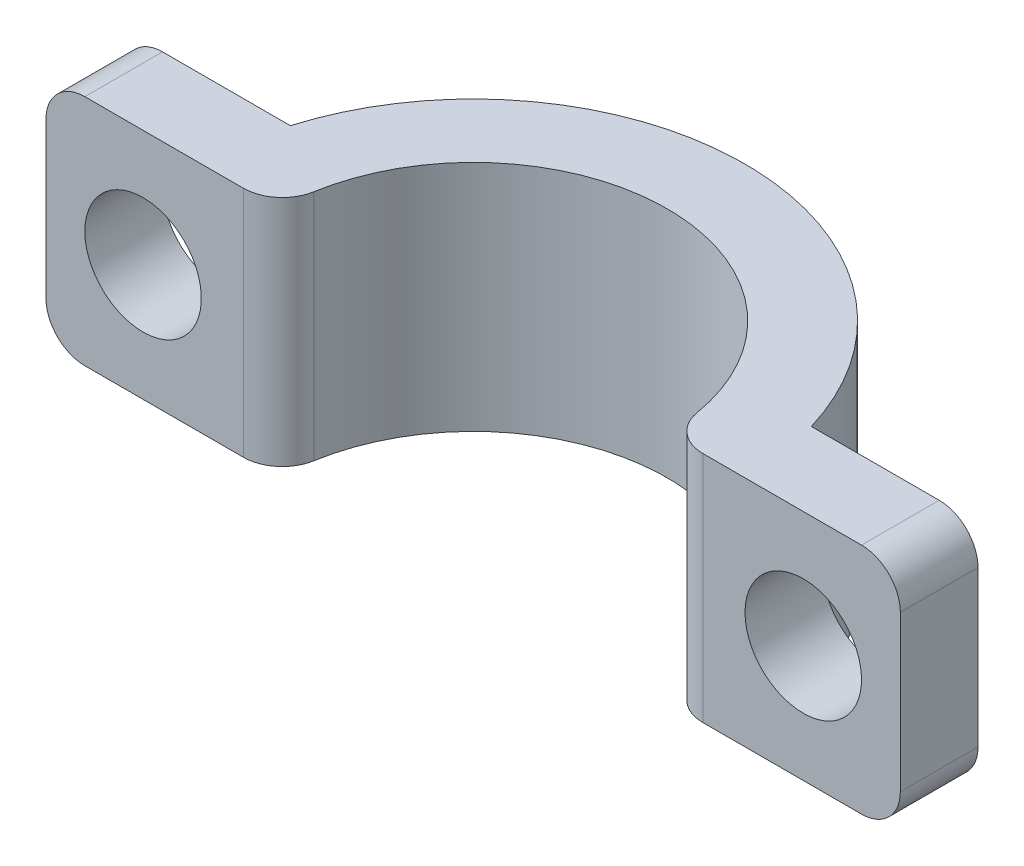
from build123d import *

# Parameters (mm, degrees)
BOSS_EXTRUDE1_DEPTH = 6
BOSS_EXTRUDE2_DEPTH = 6
SKETCH3_R           = 1.5
CUT_EXTRUDE1_DEPTH  = 6
FILLET1_R           = 1


with BuildPart() as part:
    # Sketch1 → Boss-Extrude1 (new body)
    with BuildSketch(Plane(origin=(0, 0, 0), x_dir=(1, 0, 0), z_dir=(0, 1, 0))):
        with BuildLine():
            Line((5, 0), (7, 0))
            ThreePointArc((7, 0), (0, 7), (-7, 0))
            Line((-7, 0), (-5, 0))
            ThreePointArc((-5, 0), (0, 5), (5, 0))
        make_face()
    extrude(amount=BOSS_EXTRUDE1_DEPTH)

    # Sketch2 → Boss-Extrude2 (add)
    with BuildSketch(Plane(origin=(0, 6, 0), x_dir=(1, 0, 0), z_dir=(0, 1, 0))):
        Polygon((7, 0), (11, 0), (11, 2), (6.708203932, 2), align=None)
        Polygon((-6.708203932, 2), (-7, 0), (-11, 0), (-11, 2), align=None)
    extrude(amount=-BOSS_EXTRUDE2_DEPTH)

    # Sketch3 → Cut-Extrude1 (cut)
    with BuildSketch(Plane(origin=(0, 0, -2), x_dir=(-1, 0, 0), z_dir=(0, 0, -1))):
        with Locations((-8.5, 3)):
            Circle(SKETCH3_R)
        with Locations((8.5, 3)):
            Circle(SKETCH3_R)
    extrude(amount=-CUT_EXTRUDE1_DEPTH, mode=Mode.SUBTRACT)

    # Fillet1
    fillet1_edges = [part.edges().sort_by_distance(p)[0] for p in [
        (11, 6, -1),
        (11, 0, -1),
        (-11, 6, -1),
        (-11, 0, -1),
        (-5, 3, 0),
        (5, 3, 0),
    ]]
    fillet(fillet1_edges, radius=FILLET1_R)


solid = part.part
